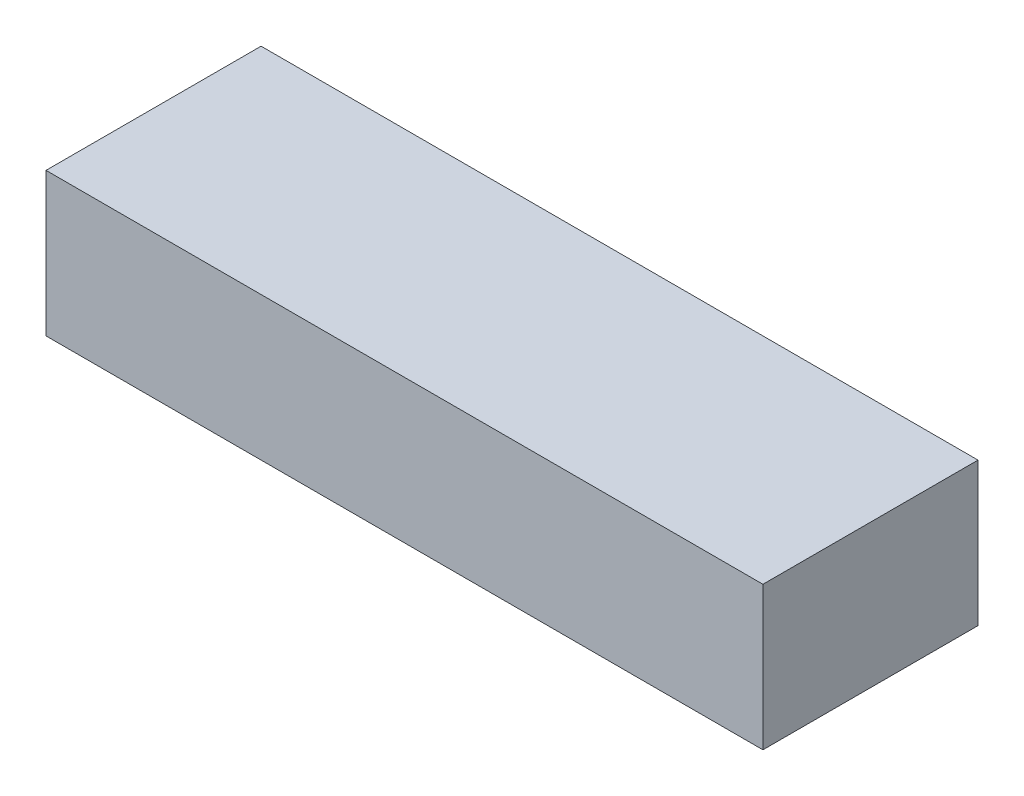
from build123d import *

# Parameters (mm, degrees)
ESBO_O1_W                = 10
ESBO_O1_H                = 2
RESSALTO_EXTRUS_O1_DEPTH = 3


with BuildPart() as part:
    # Esboço1 → Ressalto-extrusão1 (new body)
    with BuildSketch(Plane.XY):
        Rectangle(ESBO_O1_W, ESBO_O1_H)
    extrude(amount=RESSALTO_EXTRUS_O1_DEPTH)


solid = part.part
